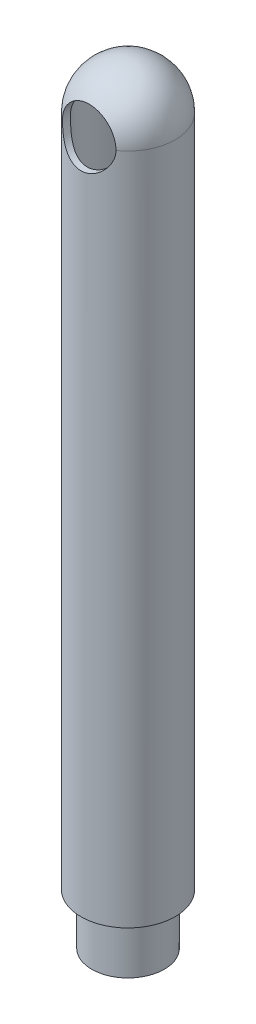
from build123d import *

# Parameters (mm, degrees)
CUT_EXTRUDE1_DEPTH      = 608.258594011
CUT_EXTRUDE1_DEPTH_BACK = 608.258594011
SKETCH2_R               = 21


with BuildPart() as part:
    # Sketch1 → Revolve1 (revolve)
    with BuildSketch(Plane.XY, mode=Mode.PRIVATE) as revolve1_sk:
        with BuildLine():
            Line((23.5, 0), (28.5, 0))
            Line((28.5, 0), (28.5, 40))
            Line((28.5, 40), (37, 40))
            Line((37, 40), (37, 568))
            ThreePointArc((37, 568), (26.162950904, 594.162950904), (0, 605))
            Line((0, 605), (0, 600))
            ThreePointArc((0, 600), (22.627416998, 590.627416998), (32, 568))
            Line((32, 568), (32, 45))
            Line((32, 45), (23.5, 45))
            Line((23.5, 45), (23.5, 0))
        make_face()
    revolve(revolve1_sk.sketch.rotate(Axis((0, 0, 0), (0, 1, 0)), 90), axis=Axis((0, 0, 0), (0, 1, 0)))

    # Sketch2 → Cut-Extrude1 (cut, two sides: drawn at the far end of the back side and taken through both)
    with BuildSketch(Plane.XY.offset(-CUT_EXTRUDE1_DEPTH_BACK)):
        with Locations((0, 568)):
            Circle(SKETCH2_R)
    extrude(amount=CUT_EXTRUDE1_DEPTH + CUT_EXTRUDE1_DEPTH_BACK, mode=Mode.SUBTRACT)


solid = part.part
